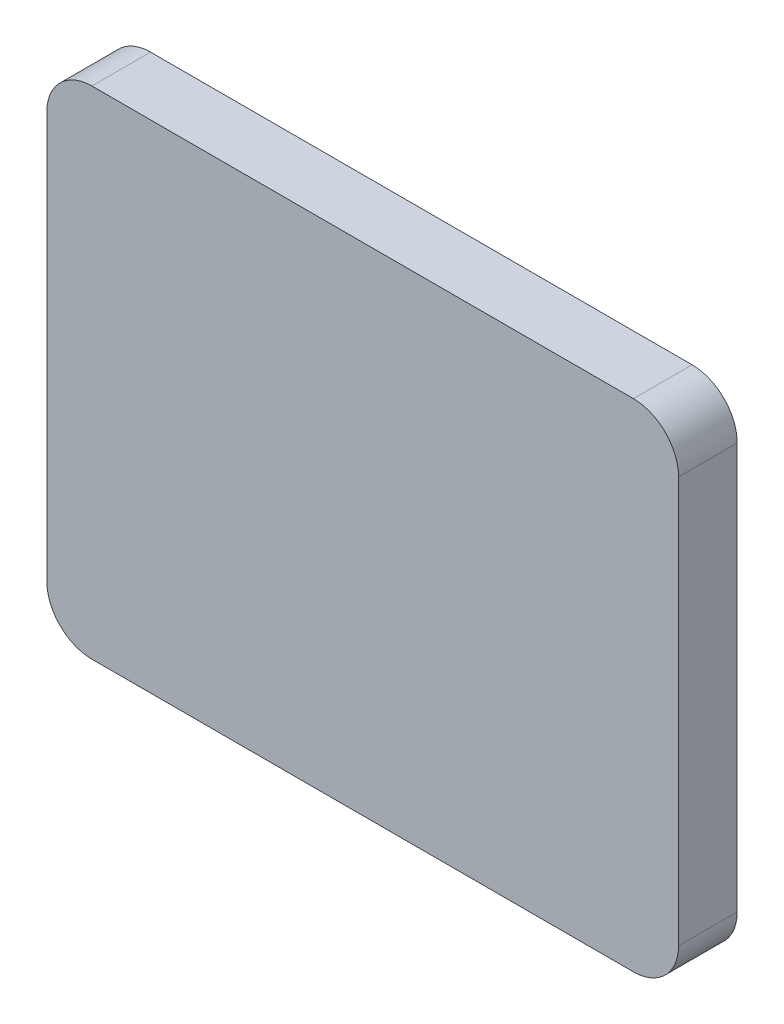
from build123d import *

# Parameters (mm, degrees)
BOSS_EXTRUDE1_DEPTH = 13
BOSS_EXTRUDE3_DEPTH = 0.5


with BuildPart() as part:
    # Sketch1 → Boss-Extrude1 (new body)
    with BuildSketch(Plane.XY):
        with BuildLine():
            Line((128.676424344, 77.084775656), (128.676424344, -12.915224344))
            ThreePointArc((128.676424344, -12.915224344), (125.747492156, -19.986292156), (118.676424344, -22.915224344))
            Line((118.676424344, -22.915224344), (-1.323575656, -22.915224344))
            ThreePointArc((-1.323575656, -22.915224344), (-8.394643467, -19.986292156), (-11.323575656, -12.915224344))
            Line((-11.323575656, -12.915224344), (-11.323575656, 77.084775656))
            ThreePointArc((-11.323575656, 77.084775656), (-8.394643467, 84.155843467), (-1.323575656, 87.084775656))
            Line((-1.323575656, 87.084775656), (118.676424344, 87.084775656))
            ThreePointArc((118.676424344, 87.084775656), (125.747492156, 84.155843467), (128.676424344, 77.084775656))
        make_face()
    extrude(amount=BOSS_EXTRUDE1_DEPTH)

    # Sketch10 → Boss-Extrude3 (add)
    with BuildSketch(Plane(origin=(0, 0, 0), x_dir=(-1, 0, 0), z_dir=(0, 0, -1))):
        with BuildLine():
            Line((-121.176424344, 74.084775656), (-120.176424344, 74.084775656))
            ThreePointArc((-120.176424344, 74.084775656), (-116.994443829, 75.40279514), (-115.676424344, 78.584775656))
            Line((-115.676424344, 78.584775656), (-115.676424344, 79.584775656))
            ThreePointArc((-115.676424344, 79.584775656), (-114.35840486, 82.766756171), (-111.176424344, 84.084775656))
            Line((-111.176424344, 84.084775656), (-6.176424344, 84.084775656))
            ThreePointArc((-6.176424344, 84.084775656), (-2.994443829, 82.766756171), (-1.676424344, 79.584775656))
            Line((-1.676424344, 79.584775656), (-1.676424344, 78.584775656))
            ThreePointArc((-1.676424344, 78.584775656), (-0.35840486, 75.40279514), (2.823575656, 74.084775656))
            Line((2.823575656, 74.084775656), (3.823575656, 74.084775656))
            ThreePointArc((3.823575656, 74.084775656), (7.005556171, 72.766756171), (8.323575656, 69.584775656))
            Line((8.323575656, 69.584775656), (8.323575656, -5.415224344))
            ThreePointArc((8.323575656, -5.415224344), (7.005556171, -8.59720486), (3.823575656, -9.915224344))
            Line((3.823575656, -9.915224344), (2.823575656, -9.915224344))
            ThreePointArc((2.823575656, -9.915224344), (-0.35840486, -11.233243829), (-1.676424344, -14.415224344))
            Line((-1.676424344, -14.415224344), (-1.676424344, -15.415224344))
            ThreePointArc((-1.676424344, -15.415224344), (-2.994443829, -18.59720486), (-6.176424344, -19.915224344))
            Line((-6.176424344, -19.915224344), (-111.176424344, -19.915224344))
            ThreePointArc((-111.176424344, -19.915224344), (-114.35840486, -18.59720486), (-115.676424344, -15.415224344))
            Line((-115.676424344, -15.415224344), (-115.676424344, -14.415224344))
            ThreePointArc((-115.676424344, -14.415224344), (-116.994443829, -11.233243829), (-120.176424344, -9.915224344))
            Line((-120.176424344, -9.915224344), (-121.176424344, -9.915224344))
            ThreePointArc((-121.176424344, -9.915224344), (-124.35840486, -8.59720486), (-125.676424344, -5.415224344))
            Line((-125.676424344, -5.415224344), (-125.676424344, 69.584775656))
            ThreePointArc((-125.676424344, 69.584775656), (-124.35840486, 72.766756171), (-121.176424344, 74.084775656))
        make_face()
        with BuildLine():
            Line((-121.176424344, 73.084775656), (-120.176424344, 73.084775656))
            ThreePointArc((-120.176424344, 73.084775656), (-116.287337048, 74.695688359), (-114.676424344, 78.584775656))
            Line((-114.676424344, 78.584775656), (-114.676424344, 79.584775656))
            ThreePointArc((-114.676424344, 79.584775656), (-113.651298079, 82.05964939), (-111.176424344, 83.084775656))
            Line((-111.176424344, 83.084775656), (-6.176424344, 83.084775656))
            ThreePointArc((-6.176424344, 83.084775656), (-3.70155061, 82.05964939), (-2.676424344, 79.584775656))
            Line((-2.676424344, 79.584775656), (-2.676424344, 78.584775656))
            ThreePointArc((-2.676424344, 78.584775656), (-1.065511641, 74.695688359), (2.823575656, 73.084775656))
            Line((2.823575656, 73.084775656), (3.823575656, 73.084775656))
            ThreePointArc((3.823575656, 73.084775656), (6.29844939, 72.05964939), (7.323575656, 69.584775656))
            Line((7.323575656, 69.584775656), (7.323575656, -5.415224344))
            ThreePointArc((7.323575656, -5.415224344), (6.29844939, -7.890098079), (3.823575656, -8.915224344))
            Line((3.823575656, -8.915224344), (2.823575656, -8.915224344))
            ThreePointArc((2.823575656, -8.915224344), (-1.065511641, -10.526137048), (-2.676424344, -14.415224344))
            Line((-2.676424344, -14.415224344), (-2.676424344, -15.415224344))
            ThreePointArc((-2.676424344, -15.415224344), (-3.70155061, -17.890098079), (-6.176424344, -18.915224344))
            Line((-6.176424344, -18.915224344), (-111.176424344, -18.915224344))
            ThreePointArc((-111.176424344, -18.915224344), (-113.651298079, -17.890098079), (-114.676424344, -15.415224344))
            Line((-114.676424344, -15.415224344), (-114.676424344, -14.415224344))
            ThreePointArc((-114.676424344, -14.415224344), (-116.287337048, -10.526137048), (-120.176424344, -8.915224344))
            Line((-120.176424344, -8.915224344), (-121.176424344, -8.915224344))
            ThreePointArc((-121.176424344, -8.915224344), (-123.651298079, -7.890098079), (-124.676424344, -5.415224344))
            Line((-124.676424344, -5.415224344), (-124.676424344, 69.584775656))
            ThreePointArc((-124.676424344, 69.584775656), (-123.651298079, 72.05964939), (-121.176424344, 73.084775656))
        make_face(mode=Mode.SUBTRACT)
    extrude(amount=BOSS_EXTRUDE3_DEPTH)


solid = part.part
